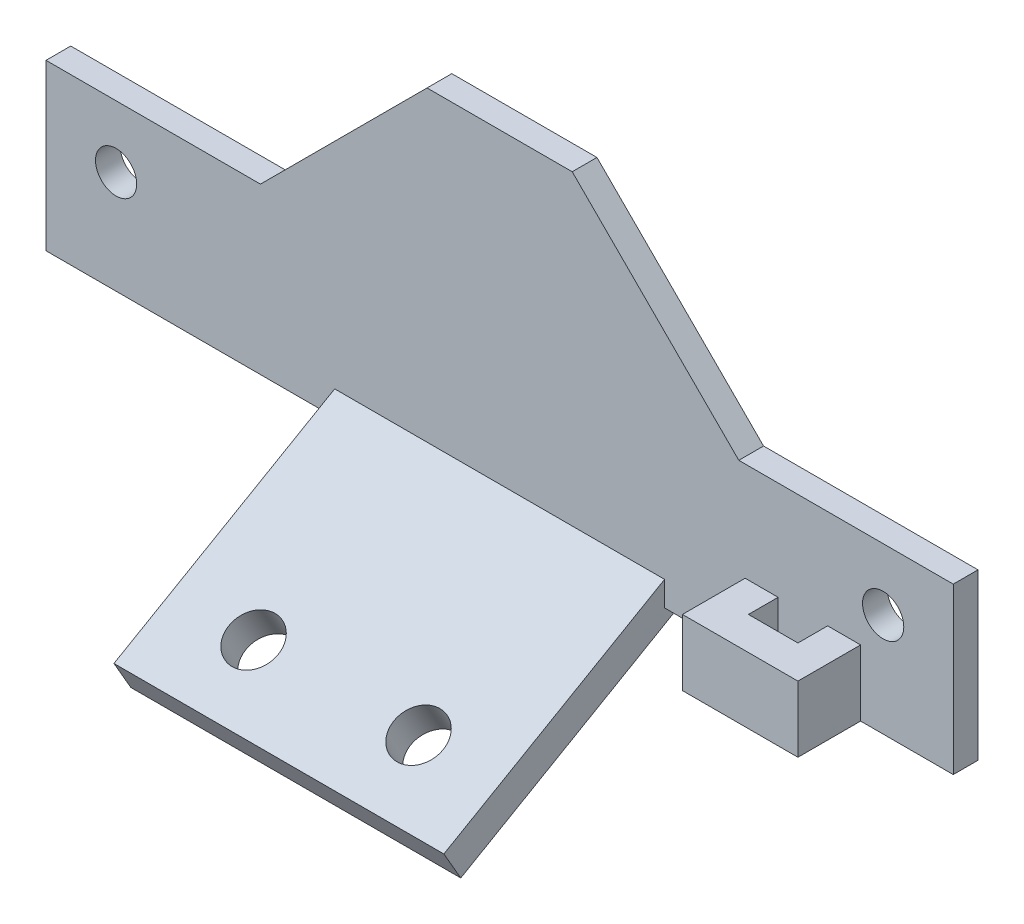
from build123d import *

# Parameters (mm, degrees)
CROQUIS1_R              = 1.25
SALIENTE_EXTRUIR1_DEPTH = 1.5
SALIENTE_EXTRUIR2_DEPTH = 55
CORTAR_EXTRUIR1_DEPTH   = 17.5
CORTAR_EXTRUIR2_DEPTH   = 17.5
CROQUIS4_R              = 1.5
CORTAR_EXTRUIR3_DEPTH   = 2.049041
SALIENTE_EXTRUIR3_DEPTH = 4


with BuildPart() as part:
    # Croquis1 → Saliente-Extruir1 (new body)
    with BuildSketch(Plane.XY):
        Polygon((-68.837310195, 14.25), (-55.837310195, 14.25), (-45.737310195, 24.35), (-36.937310195, 24.35), (-26.837310195, 14.25), (-13.837310195, 14.25), (-13.837310195, 4.25), (-68.837310195, 4.25), align=None)
        with Locations((-18.087310195, 10.5)):
            Circle(CROQUIS1_R, mode=Mode.SUBTRACT)
        with Locations((-64.587310195, 10.5)):
            Circle(CROQUIS1_R, mode=Mode.SUBTRACT)
    extrude(amount=SALIENTE_EXTRUIR1_DEPTH)

    # Croquis2 → Saliente-Extruir2 (add)
    with BuildSketch(Plane.ZY.offset(68.837310195)):
        Polygon((13.856406461, -3.75), (14.880925513, -1.975480947), (1.5, 5.75), (1.5, 4.25), (0, 4.25), align=None)
    extrude(amount=-SALIENTE_EXTRUIR2_DEPTH)

    # Croquis2<2> → Cortar-Extruir1 (cut)
    with BuildSketch(Plane.ZY.offset(68.837310195)):
        Polygon((13.856406461, -3.75), (14.880925513, -1.975480947), (1.5, 5.75), (1.5, 4.25), (0, 4.25), align=None)
    extrude(amount=-CORTAR_EXTRUIR1_DEPTH, mode=Mode.SUBTRACT)

    # Croquis3 → Cortar-Extruir2 (cut)
    with BuildSketch(Plane(origin=(-13.837310195, 0, 0), x_dir=(0, 0, -1), z_dir=(1, 0, 0))):
        Polygon((-1.5, 5.75), (-14.880925513, -1.975480947), (-13.856406461, -3.75), (0, 4.25), (-1.5, 4.25), align=None)
    extrude(amount=-CORTAR_EXTRUIR2_DEPTH, mode=Mode.SUBTRACT)

    # Croquis4 → Cortar-Extruir3 (cut)
    with BuildSketch(Plane(origin=(0, 3.1875, 1.840303983), x_dir=(1, 0, 0), z_dir=(0, -0.8660254037844399, -0.4999999999999978))):
        with Locations(Location((-36.337310195, 9.875, 0), (0, 0, 270))):
            Circle(CROQUIS4_R)
        with Locations(Location((-46.337310195, 9.875, 0), (0, 0, 270))):
            Circle(CROQUIS4_R)
    extrude(amount=-CORTAR_EXTRUIR3_DEPTH, mode=Mode.SUBTRACT)

    # Croquis5 → Saliente-Extruir3 (add)
    with BuildSketch(Plane.XZ.offset(-4.25)):
        Polygon((-26.454313708, 1.5), (-24.454313708, 1.5), (-24.454313708, 3.3), (-21.454313708, 3.3), (-21.454313708, 1.5), (-19.454313708, 1.5), (-19.454313708, 5.3), (-26.454313708, 5.3), align=None)
    extrude(amount=-SALIENTE_EXTRUIR3_DEPTH)


solid = part.part
